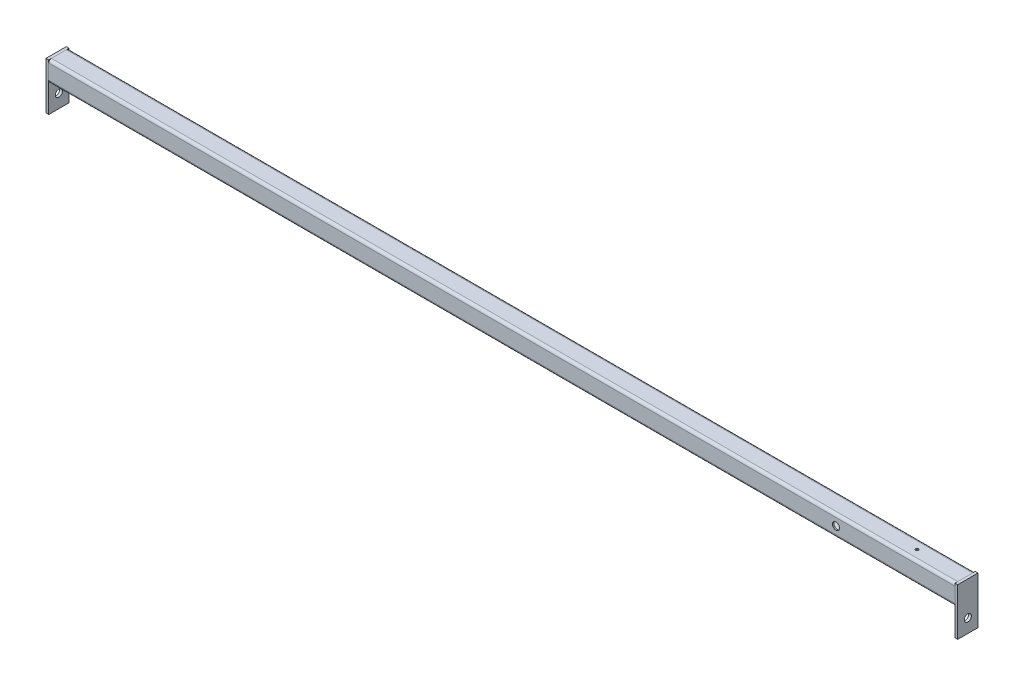
from build123d import *

# Parameters (mm, degrees)
SQUARE_TUBE_CONFIGURED_30_X_30_X_2_DEPTH = 1344
SKETCH11_W                               = 4
SKETCH11_H                               = 30
STEEL_BAR_CONFIGURED_30_X_2_DEPTH        = 70
SKETCH11_ON_SEGMENT_2_W                  = 4
SKETCH11_ON_SEGMENT_2_H                  = 30
STEEL_BAR_CONFIGURED_30_X_2_2_DEPTH      = 70
SKETCH13_W                               = 5.25
SKETCH13_H                               = 1348
SKETCH16_W                               = 5.25
SKETCH16_H                               = 30
SKETCH20_W                               = 2.1
SKETCH20_H                               = 30


with BuildPart() as part:
    # Sketch1 → Square tube - configured 30 X 30 X 2 (new body)
    with BuildSketch(Plane(origin=(0, 55, 0), x_dir=(0, 0, -1), z_dir=(1, 0, 0))):
        with BuildLine():
            Line((-11, -15), (11, -15))
            ThreePointArc((11, -15), (13.828427125, -13.828427125), (15, -11))
            Line((15, -11), (15, 11))
            ThreePointArc((15, 11), (13.828427125, 13.828427125), (11, 15))
            Line((11, 15), (-11, 15))
            ThreePointArc((-11, 15), (-13.828427125, 13.828427125), (-15, 11))
            Line((-15, 11), (-15, -11))
            ThreePointArc((-15, -11), (-13.828427125, -13.828427125), (-11, -15))
        make_face()
        with BuildLine():
            Line((-11, -13), (11, -13))
            ThreePointArc((11, -13), (12.414213562, -12.414213562), (13, -11))
            Line((13, -11), (13, 11))
            ThreePointArc((13, 11), (12.414213562, 12.414213562), (11, 13))
            Line((11, 13), (-11, 13))
            ThreePointArc((-11, 13), (-12.414213562, 12.414213562), (-13, 11))
            Line((-13, 11), (-13, -11))
            ThreePointArc((-13, -11), (-12.414213562, -12.414213562), (-11, -13))
        make_face(mode=Mode.SUBTRACT)
    extrude(amount=SQUARE_TUBE_CONFIGURED_30_X_30_X_2_DEPTH)

    # Trim/Extend1
    split(bisect_by=Plane(origin=(1342, 35, 0), x_dir=(0, -1, 0), z_dir=(-1, 0, 0)), keep=Keep.TOP)

    # Trim_Extend1 3
    split(bisect_by=Plane(origin=(2, 35, 0), x_dir=(0, 1, 0), z_dir=(1, 0, 0)), keep=Keep.TOP)

    # Sketch16 → Ø10.5 (10.5) PC Shelf Mount Hole (revolve, cut)
    with BuildSketch(Plane(origin=(1166, 55, 15), x_dir=(0, -1, 0), z_dir=(1, 0, 0))):
        with Locations((2.625, 15)):
            Rectangle(SKETCH16_W, SKETCH16_H)
    revolve(axis=Axis((1166, 55, 21.35), (0, 0, -1)), mode=Mode.SUBTRACT)

    # Sketch20 → Ø4.2 (4.2) PC Shelf Table Mount Hole (revolve, cut)
    with BuildSketch(Plane(origin=(1271, 40, 0), x_dir=(0, 0, -1), z_dir=(1, 0, 0))):
        with Locations((1.05, 15)):
            Rectangle(SKETCH20_W, SKETCH20_H)
    revolve(axis=Axis((1271, 33.65, 0), (0, 1, 0)), mode=Mode.SUBTRACT)


with BuildPart() as body_2:
    # Sketch11 → Steel bar - configured 30 X 2 (new body)
    with BuildSketch(Plane(origin=(0, 0, 0), x_dir=(1, 0, 0), z_dir=(0, 1, 0))):
        Rectangle(SKETCH11_W, SKETCH11_H)
    extrude(amount=STEEL_BAR_CONFIGURED_30_X_2_DEPTH)


with BuildPart() as body_3:
    # Sketch11 on segment 2 (carried to segment 2) → Steel bar - configured 30 X 2 2 (new body)
    with BuildSketch(Plane(origin=(1344, 0, 0), x_dir=(1, 0, 0), z_dir=(0, 1, 0))):
        Rectangle(SKETCH11_ON_SEGMENT_2_W, SKETCH11_ON_SEGMENT_2_H)
    extrude(amount=STEEL_BAR_CONFIGURED_30_X_2_2_DEPTH)


with BuildPart() as f_10_5_10_5_frame_mount_holes_tool:
    # Sketch13 → Ø10.5 (10.5) Frame Mount Holes (revolve)
    with BuildSketch(Plane(origin=(1346, 20, 0), x_dir=(0, 0, -1), z_dir=(0, 1, 0))):
        with Locations((2.625, 674)):
            Rectangle(SKETCH13_W, SKETCH13_H)
    revolve(axis=Axis((1352.35, 20, 0), (-1, 0, 0)))


with BuildPart() as body_2_1:
    add(body_2.part)

    # Ø10.5 (10.5) Frame Mount Holes: cut by f_10_5_10_5_frame_mount_holes_tool
    add(f_10_5_10_5_frame_mount_holes_tool.part, mode=Mode.SUBTRACT)


with BuildPart() as body_3_1:
    add(body_3.part)

    # Ø10.5 (10.5) Frame Mount Holes: cut by f_10_5_10_5_frame_mount_holes_tool
    add(f_10_5_10_5_frame_mount_holes_tool.part, mode=Mode.SUBTRACT)


solid = Compound([part.part, body_2_1.part, body_3_1.part])
